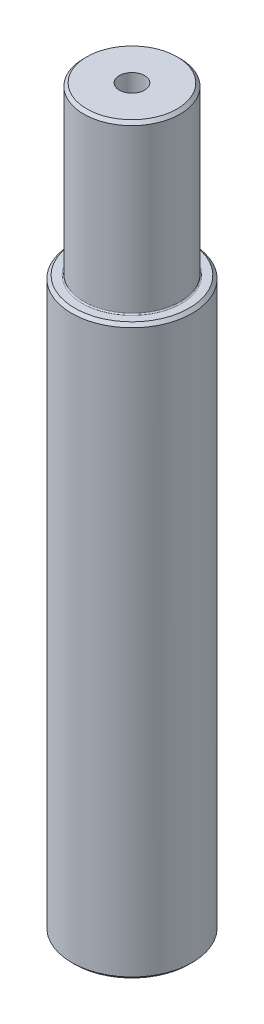
from build123d import *

# Parameters (mm, degrees)
FILLET1_R     = 0.2
CHAMFER1_SIZE = 0.5


with BuildPart() as part:
    # Sketch1 → Revolve1 (revolve)
    with BuildSketch(Plane.XY, mode=Mode.PRIVATE) as revolve1_sk:
        Polygon((0, 0), (10, 0), (10, 94.35), (8, 94.35), (8, 122), (0, 122), align=None)
    revolve(revolve1_sk.sketch.rotate(Axis((0, 7.476190476, 0), (0, -1, 0)), 90), axis=Axis((0, 7.476190476, 0), (0, -1, 0)))

    # Sketch4 → M5 Tapped Hole1 (revolve, cut)
    with BuildSketch(Plane(origin=(0, 0, 0), x_dir=(0, 0, -1), z_dir=(1, 0, 0))):
        Polygon((0, 0), (0, 13.6618073), (2.1, 12.4), (2.1, 0), align=None)
    m5_tapped_hole1 = revolve(axis=Axis((0, -6.35, 0), (0, 1, 0)), mode=Mode.SUBTRACT)

    # Mirror1: M5 Tapped Hole1 across plane
    add(m5_tapped_hole1.mirror(Plane(origin=(0, 61, 0), x_dir=(0, 0, 1), z_dir=(0, -1, 0))), mode=Mode.SUBTRACT)

    # Fillet1
    fillet1_edges = [part.edges().sort_by_distance(p)[0] for p in [
        (0, 94.35, -8),
    ]]
    fillet(fillet1_edges, radius=FILLET1_R)

    # Chamfer1
    chamfer1_edges = [part.edges().sort_by_distance(p)[0] for p in [
        (0, 122, -8),
        (0, 94.35, -10),
        (0, 0, -10),
    ]]
    chamfer(chamfer1_edges, length=CHAMFER1_SIZE)


solid = part.part
